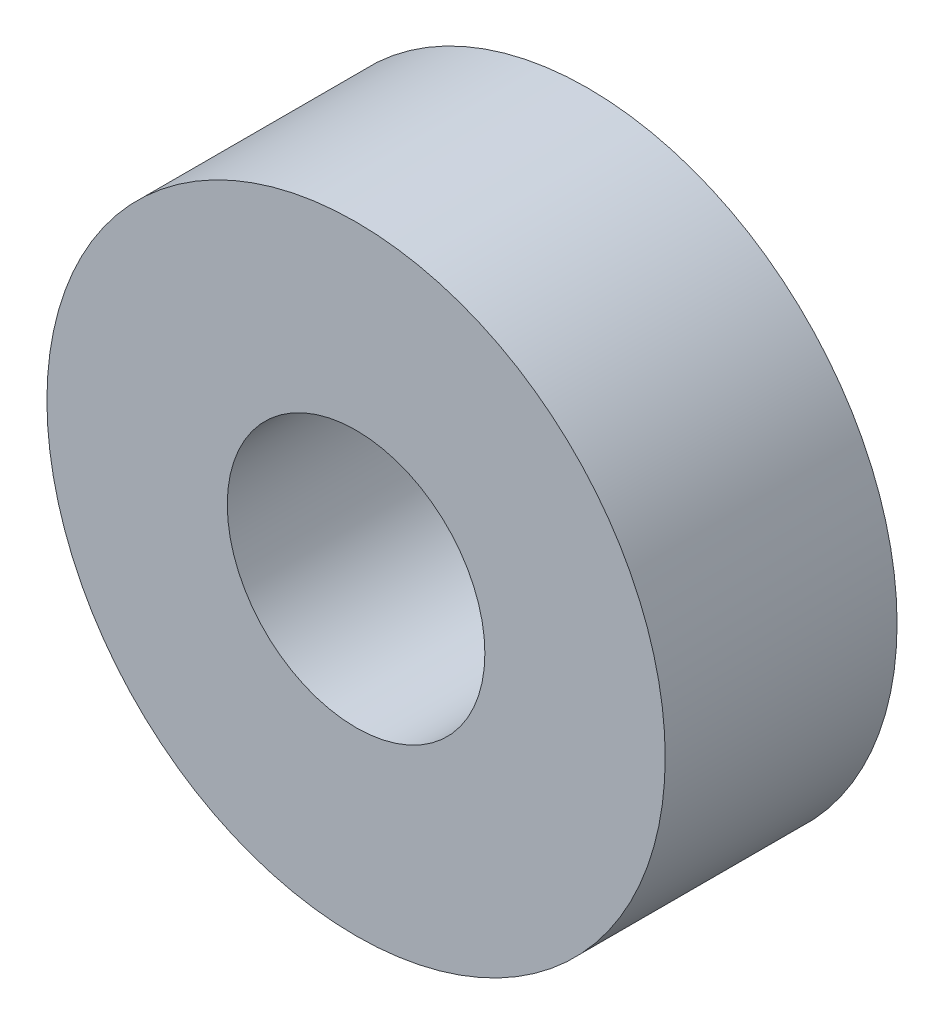
from build123d import *

# Parameters (mm, degrees)
SZKIC1_R                    = 12
SZKIC1_R_2                  = 5
DODANIE_WYCI_GNI_CIE1_DEPTH = 9


with BuildPart() as part:
    # Szkic1 → Dodanie-wyciągnięcie1 (new body)
    with BuildSketch(Plane.XY):
        with Locations((521.379553039, -27.902840626)):
            Circle(SZKIC1_R)
        with Locations((521.379553039, -27.902840626)):
            Circle(SZKIC1_R_2, mode=Mode.SUBTRACT)
    extrude(amount=DODANIE_WYCI_GNI_CIE1_DEPTH)


solid = part.part
